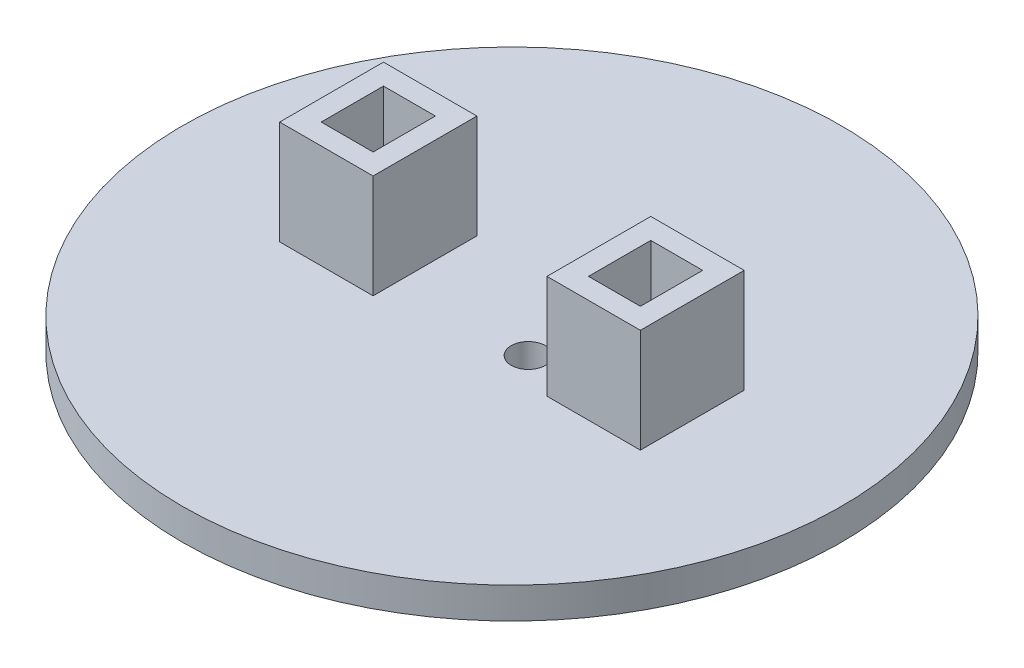
from build123d import *

# Parameters (mm, degrees)
SKETCH1_R           = 31.75
SKETCH1_R_2         = 1.65
BOSS_EXTRUDE1_DEPTH = 3
SKETCH2_W           = 9
SKETCH2_H           = 10
SKETCH2_W_2         = 5
SKETCH2_H_2         = 6
BOSS_EXTRUDE2_DEPTH = 10


with BuildPart() as part:
    # Sketch1 → Boss-Extrude1 (new body)
    with BuildSketch(Plane(origin=(0, 0, 0), x_dir=(1, 0, 0), z_dir=(0, 1, 0))):
        with Locations(Location((0, 0, 0), (0, 0, 270))):
            Circle(SKETCH1_R)
        with Locations(Location((4.08, 2.5, 0), (0, 0, 270))):
            Circle(SKETCH1_R_2, mode=Mode.SUBTRACT)
        with Locations(Location((4.08, -2.5, 0), (0, 0, 270))):
            Circle(SKETCH1_R_2, mode=Mode.SUBTRACT)
    extrude(amount=BOSS_EXTRUDE1_DEPTH)

    # Sketch2 → Boss-Extrude2 (add)
    # profile 1 of 2: a face of its own
    with BuildSketch(Plane(origin=(0, 3, 0), x_dir=(1, 0, 0), z_dir=(0, 1, 0))):
        with Locations((12.875, 0)):
            Rectangle(SKETCH2_W, SKETCH2_H)
        with Locations((12.875, 0)):
            Rectangle(SKETCH2_W_2, SKETCH2_H_2, mode=Mode.SUBTRACT)
    # profile 2 of 2: a face of its own
    with BuildSketch(Plane(origin=(0, 3, 0), x_dir=(1, 0, 0), z_dir=(0, 1, 0))):
        with Locations((-12.875, 0)):
            Rectangle(SKETCH2_W, SKETCH2_H)
        with Locations((-12.875, 0)):
            Rectangle(SKETCH2_W_2, SKETCH2_H_2, mode=Mode.SUBTRACT)
    extrude(amount=BOSS_EXTRUDE2_DEPTH)


solid = part.part
